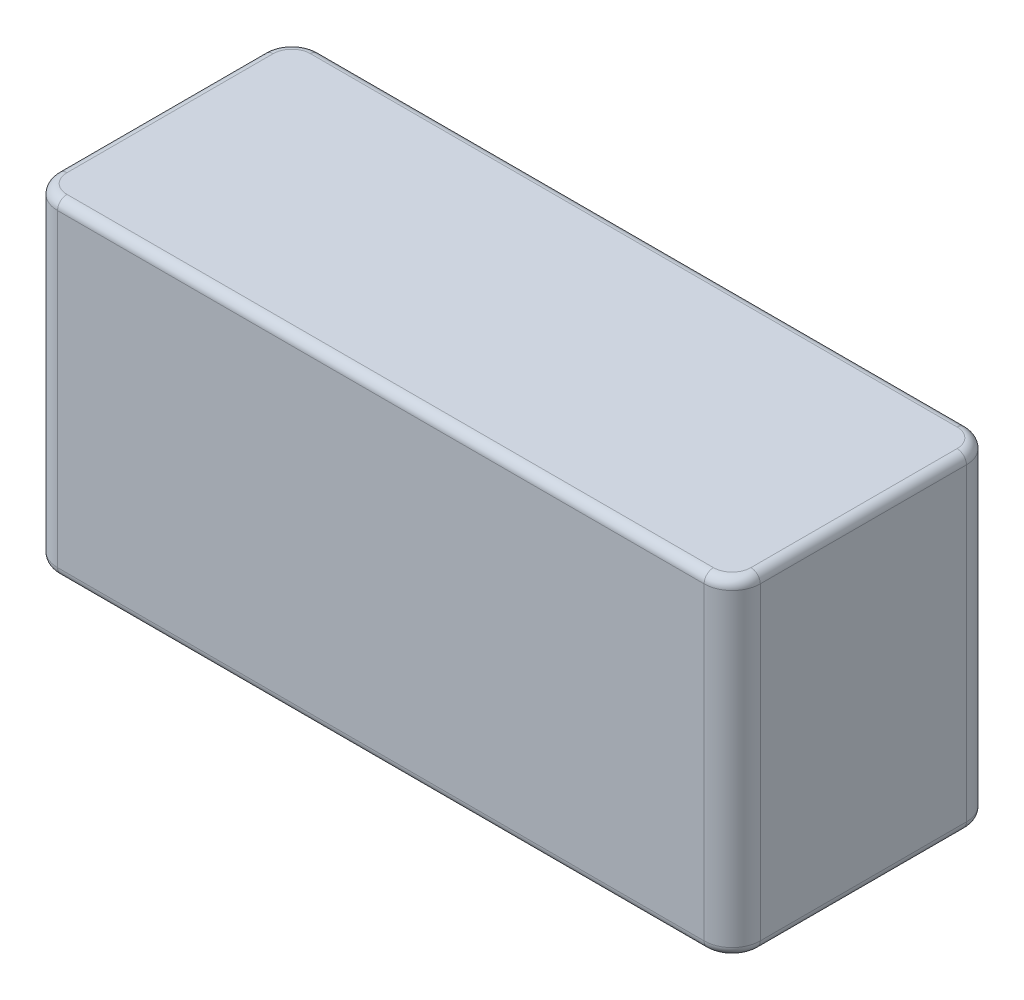
from build123d import *

# Parameters (mm, degrees)
SKETCH1_W           = 75
SKETCH1_H           = 28
BOSS_EXTRUDE1_DEPTH = 35
FILLET1_R           = 3
FILLET2_R           = 1


with BuildPart() as part:
    # Sketch1 → Boss-Extrude1 (new body)
    with BuildSketch(Plane(origin=(0, 0, 0), x_dir=(1, 0, 0), z_dir=(0, 1, 0))):
        Rectangle(SKETCH1_W, SKETCH1_H)
    extrude(amount=BOSS_EXTRUDE1_DEPTH)

    # Fillet1
    fillet1_edges = [part.edges().sort_by_distance(p)[0] for p in [
        (37.5, 17.5, 14),
        (-37.5, 17.5, 14),
        (-37.5, 17.5, -14),
        (37.5, 17.5, -14),
    ]]
    fillet(fillet1_edges, radius=FILLET1_R)

    # Fillet2
    fillet2_edges = [part.edges().sort_by_distance(p)[0] for p in [
        (0, 0, 14),
        (0, 35, 14),
        (37.5, 0, 0),
        (-37.5, 0, 0),
        (0, 0, -14),
        (36.621320344, 0, 13.121320344),
        (36.621320344, 0, -13.121320344),
        (-36.621320344, 0, -13.121320344),
        (-36.621320344, 0, 13.121320344),
        (-37.5, 35, 0),
        (37.5, 35, 0),
        (0, 35, -14),
        (36.621320344, 35, 13.121320344),
        (36.621320344, 35, -13.121320344),
        (-36.621320344, 35, -13.121320344),
        (-36.621320344, 35, 13.121320344),
    ]]
    fillet(fillet2_edges, radius=FILLET2_R)


solid = part.part
